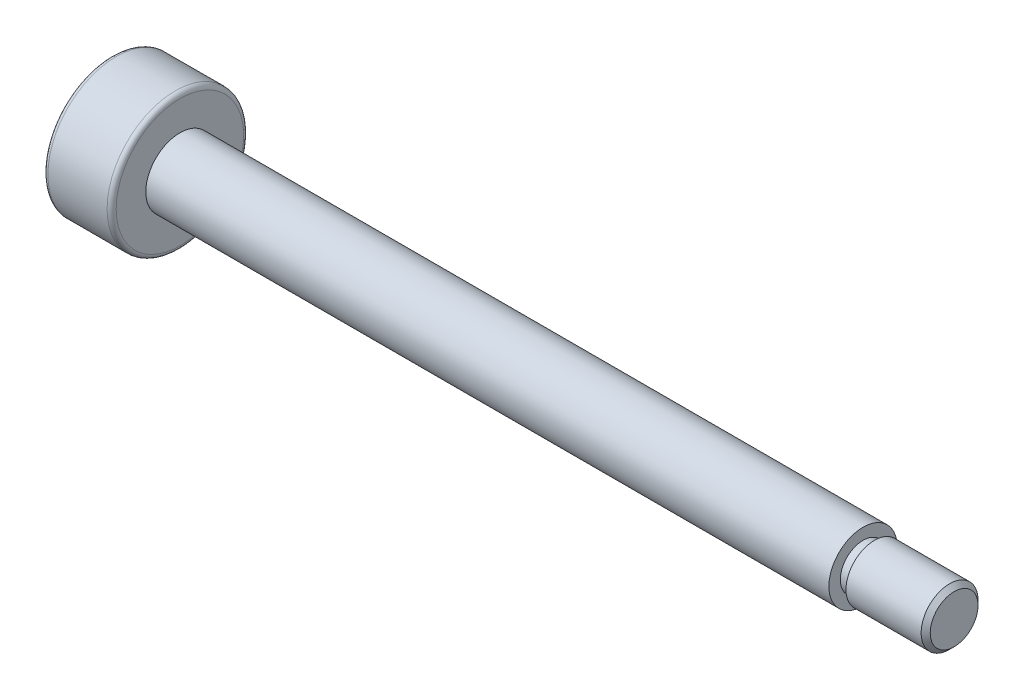
from build123d import *

# Parameters (mm, degrees)
FILLET_1_R          = 0.2
CHAMFER_1_SIZE      = 0.2
SKETCH_3_W          = 0.5
SKETCH_3_H          = 0.25
CUT_EXTRUDE_1_DEPTH = 2


with BuildPart() as part:
    # 草图1 → 旋转1 (revolve)
    with BuildSketch(Plane.XY, mode=Mode.PRIVATE) as revolve_1_sk:
        Polygon((-18.5, 0), (-18.5, 3), (-15.5, 3), (-15.5, 1.5), (14.5, 1.5), (14.5, 1.25), (18.5, 1.25), (18.5, 0), align=None)
    revolve(revolve_1_sk.sketch.rotate(Axis((-18.5, 0, 0), (1, 0, 0)), 90), axis=Axis((-18.5, 0, 0), (1, 0, 0)))

    # 圆角1
    fillet_1_edges = [part.edges().sort_by_distance(p)[0] for p in [
        (-15.5, 0, -3),
        (-18.5, 0, -3),
    ]]
    fillet(fillet_1_edges, radius=FILLET_1_R)

    # 倒角1
    chamfer_1_edges = [part.edges().sort_by_distance(p)[0] for p in [
        (18.5, 0, -1.25),
    ]]
    chamfer(chamfer_1_edges, length=CHAMFER_1_SIZE)

    # 草图3 → 切除-旋转1 (revolve, cut)
    with BuildSketch(Plane.XY, mode=Mode.PRIVATE) as cut_revolve_1_sk:
        with Locations((14.75, 1.125)):
            Rectangle(SKETCH_3_W, SKETCH_3_H)
    revolve(cut_revolve_1_sk.sketch.rotate(Axis((14.5, 0, 0), (1, 0, 0)), 90), axis=Axis((14.5, 0, 0), (1, 0, 0)), mode=Mode.SUBTRACT)

    # 草图4 → 切除-拉伸1 (cut)
    with BuildSketch(Plane.ZY.offset(18.5)):
        Polygon((1.732050808, 0), (0.866025404, 1.5), (-0.866025404, 1.5), (-1.732050808, 0), (-0.866025404, -1.5), (0.866025404, -1.5), align=None)
    extrude(amount=-CUT_EXTRUDE_1_DEPTH, mode=Mode.SUBTRACT)


solid = part.part
